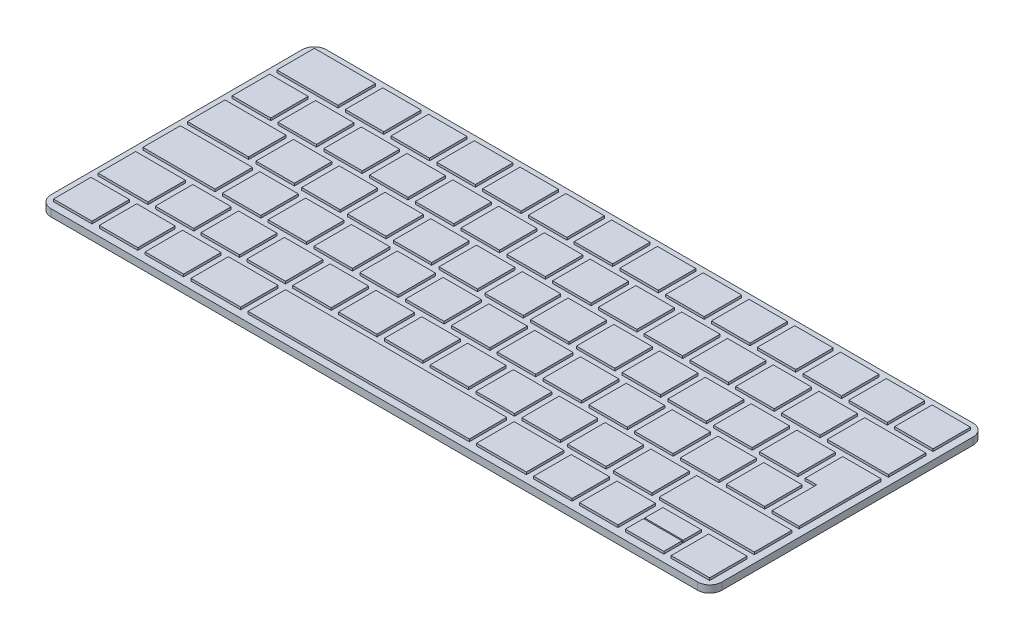
from build123d import *

# Parameters (mm, degrees)
SKETCH2_W       = 114.5
SKETCH2_H       = 3
BODY_DEPTH      = 139.5
SKETCH3_W       = 16
SKETCH3_H       = 15.583333333
SKETCH3_W_2     = 20.7
SKETCH3_W_3     = 92
SKETCH3_H_2     = 15.583333334
SKETCH3_W_4     = 39.536363636
SKETCH3_W_5     = 30
SKETCH3_W_6     = 11.2
SKETCH3_W_7     = 25.4
KEYS_A_DEPTH    = 1
SKETCH4_W       = 25.4
SKETCH4_H       = 15.583333333
SKETCH4_W_2     = 15.984615384
SKETCH4_W_3     = 15.984615385
KEYS_B_DEPTH    = 1
KEY_ENTER_REACH = 182.517
SKETCH5_W       = 11.2
SKETCH5_H       = 3
SKETCH6_W       = 16
SKETCH6_H       = 0.5
SLIT_DEPTH      = 1
CORNER_R        = 5


with BuildPart() as part:
    # Sketch2 → Body (new, symmetric)
    with BuildSketch(Plane(origin=(0, 0, 0), x_dir=(0, 0, -1), z_dir=(1, 0, 0))):
        with Locations((-57.25, 1.5)):
            Rectangle(SKETCH2_W, SKETCH2_H)
    extrude(amount=BODY_DEPTH, both=True)

    # Sketch3 → Keys A (add)
    with BuildSketch(Plane(origin=(0, 3, 0), x_dir=(1, 0, 0), z_dir=(0, 1, 0))):
        with Locations((-128.445454545, -103.708333334)):
            Rectangle(SKETCH3_W, SKETCH3_H)
        with Locations((-109.390909091, -103.708333334)):
            Rectangle(SKETCH3_W, SKETCH3_H)
        with Locations((-90.336363636, -103.708333334)):
            Rectangle(SKETCH3_W, SKETCH3_H)
        with Locations((-68.931818182, -103.708333334)):
            Rectangle(SKETCH3_W_2, SKETCH3_H)
        with Locations((-9.527272727, -103.708333334)):
            Rectangle(SKETCH3_W_3, SKETCH3_H)
        with Locations((49.877272727, -103.708333334)):
            Rectangle(SKETCH3_W_2, SKETCH3_H)
        with Locations((71.281818182, -103.708333334)):
            Rectangle(SKETCH3_W, SKETCH3_H)
        with Locations((90.336363636, -103.708333334)):
            Rectangle(SKETCH3_W, SKETCH3_H)
        with Locations((109.390909091, -103.708333334)):
            Rectangle(SKETCH3_W, SKETCH3_H)
        with Locations((128.445454545, -103.708333334)):
            Rectangle(SKETCH3_W, SKETCH3_H)
        with Locations((-126.095454545, -85.125)):
            Rectangle(SKETCH3_W_2, SKETCH3_H_2)
        with Locations((-104.690909091, -85.125)):
            Rectangle(SKETCH3_W, SKETCH3_H_2)
        with Locations((-85.636363636, -85.125)):
            Rectangle(SKETCH3_W, SKETCH3_H_2)
        with Locations((-66.581818182, -85.125)):
            Rectangle(SKETCH3_W, SKETCH3_H_2)
        with Locations((-47.527272727, -85.125)):
            Rectangle(SKETCH3_W, SKETCH3_H_2)
        with Locations((-28.472727273, -85.125)):
            Rectangle(SKETCH3_W, SKETCH3_H_2)
        with Locations((-9.418181818, -85.125)):
            Rectangle(SKETCH3_W, SKETCH3_H_2)
        with Locations((9.636363636, -85.125)):
            Rectangle(SKETCH3_W, SKETCH3_H_2)
        with Locations((28.690909091, -85.125)):
            Rectangle(SKETCH3_W, SKETCH3_H_2)
        with Locations((47.745454545, -85.125)):
            Rectangle(SKETCH3_W, SKETCH3_H_2)
        with Locations((66.8, -85.125)):
            Rectangle(SKETCH3_W, SKETCH3_H_2)
        with Locations((85.854545455, -85.125)):
            Rectangle(SKETCH3_W, SKETCH3_H_2)
        with Locations((116.677272727, -85.125)):
            Rectangle(SKETCH3_W_4, SKETCH3_H_2)
        with Locations((-121.445454545, -66.541666667)):
            Rectangle(SKETCH3_W_5, SKETCH3_H)
        with Locations((-95.392307692, -66.541666667)):
            Rectangle(SKETCH3_W, SKETCH3_H)
        with Locations((-76.339160839, -66.541666667)):
            Rectangle(SKETCH3_W, SKETCH3_H)
        with Locations((130.845454545, -66.541666667)):
            Rectangle(SKETCH3_W_6, SKETCH3_H)
        with Locations((-57.286013986, -66.541666667)):
            Rectangle(SKETCH3_W, SKETCH3_H)
        with Locations((-38.232867133, -66.541666667)):
            Rectangle(SKETCH3_W, SKETCH3_H)
        with Locations((-19.17972028, -66.541666667)):
            Rectangle(SKETCH3_W, SKETCH3_H)
        with Locations((-0.126573427, -66.541666667)):
            Rectangle(SKETCH3_W, SKETCH3_H)
        with Locations((18.926573427, -66.541666667)):
            Rectangle(SKETCH3_W, SKETCH3_H)
        with Locations((37.97972028, -66.541666667)):
            Rectangle(SKETCH3_W, SKETCH3_H)
        with Locations((57.032867133, -66.541666667)):
            Rectangle(SKETCH3_W, SKETCH3_H)
        with Locations((76.086013986, -66.541666667)):
            Rectangle(SKETCH3_W, SKETCH3_H)
        with Locations((95.139160839, -66.541666667)):
            Rectangle(SKETCH3_W, SKETCH3_H)
        with Locations((114.192307692, -66.541666667)):
            Rectangle(SKETCH3_W, SKETCH3_H)
        with Locations((-128.445454545, -29.375)):
            Rectangle(SKETCH3_W, SKETCH3_H_2)
        with Locations((-109.407692308, -29.375)):
            Rectangle(SKETCH3_W, SKETCH3_H_2)
        with Locations((-90.36993007, -29.375)):
            Rectangle(SKETCH3_W, SKETCH3_H_2)
        with Locations((-71.332167832, -29.375)):
            Rectangle(SKETCH3_W, SKETCH3_H_2)
        with Locations((-52.294405594, -29.375)):
            Rectangle(SKETCH3_W, SKETCH3_H_2)
        with Locations((-33.256643357, -29.375)):
            Rectangle(SKETCH3_W, SKETCH3_H_2)
        with Locations((-14.218881119, -29.375)):
            Rectangle(SKETCH3_W, SKETCH3_H_2)
        with Locations((4.818881119, -29.375)):
            Rectangle(SKETCH3_W, SKETCH3_H_2)
        with Locations((23.856643357, -29.375)):
            Rectangle(SKETCH3_W, SKETCH3_H_2)
        with Locations((42.894405594, -29.375)):
            Rectangle(SKETCH3_W, SKETCH3_H_2)
        with Locations((61.932167832, -29.375)):
            Rectangle(SKETCH3_W, SKETCH3_H_2)
        with Locations((80.96993007, -29.375)):
            Rectangle(SKETCH3_W, SKETCH3_H_2)
        with Locations((100.007692308, -29.375)):
            Rectangle(SKETCH3_W, SKETCH3_H_2)
        with Locations((123.745454545, -29.375)):
            Rectangle(SKETCH3_W_7, SKETCH3_H_2)
    extrude(amount=KEYS_A_DEPTH)

    # Sketch4 → Keys B (add)
    with BuildSketch(Plane(origin=(0, 3, 0), x_dir=(1, 0, 0), z_dir=(0, 1, 0))):
        with Locations((-123.745454545, -47.958333334)):
            Rectangle(SKETCH4_W, SKETCH4_H)
        with Locations((-100, -47.958333334)):
            Rectangle(SKETCH4_W_2, SKETCH4_H)
        with Locations((-80.962237762, -47.958333334)):
            Rectangle(SKETCH4_W_3, SKETCH4_H)
        with Locations((-61.924475525, -47.958333334)):
            Rectangle(SKETCH4_W_3, SKETCH4_H)
        with Locations((-42.886713287, -47.958333334)):
            Rectangle(SKETCH4_W_3, SKETCH4_H)
        with Locations((-23.848951049, -47.958333334)):
            Rectangle(SKETCH4_W_2, SKETCH4_H)
        with Locations((-4.811188811, -47.958333334)):
            Rectangle(SKETCH4_W_2, SKETCH4_H)
        with Locations((14.226573427, -47.958333334)):
            Rectangle(SKETCH4_W_3, SKETCH4_H)
        with Locations((33.264335665, -47.958333334)):
            Rectangle(SKETCH4_W_3, SKETCH4_H)
        with Locations((52.302097902, -47.958333334)):
            Rectangle(SKETCH4_W_2, SKETCH4_H)
        with Locations((71.33986014, -47.958333334)):
            Rectangle(SKETCH4_W_2, SKETCH4_H)
        with Locations((90.377622378, -47.958333334)):
            Rectangle(SKETCH4_W_3, SKETCH4_H)
        with Locations((109.415384616, -47.958333334)):
            Rectangle(SKETCH4_W_3, SKETCH4_H)
        with Locations((-123.745454545, -10.791666667)):
            Rectangle(SKETCH4_W, SKETCH4_H)
        with Locations((-100, -10.791666667)):
            Rectangle(SKETCH4_W_2, SKETCH4_H)
        with Locations((-80.962237762, -10.791666667)):
            Rectangle(SKETCH4_W_3, SKETCH4_H)
        with Locations((-61.924475525, -10.791666667)):
            Rectangle(SKETCH4_W_3, SKETCH4_H)
        with Locations((-42.886713287, -10.791666667)):
            Rectangle(SKETCH4_W_3, SKETCH4_H)
        with Locations((-23.848951049, -10.791666667)):
            Rectangle(SKETCH4_W_2, SKETCH4_H)
        with Locations((-4.811188811, -10.791666667)):
            Rectangle(SKETCH4_W_2, SKETCH4_H)
        with Locations((14.226573427, -10.791666667)):
            Rectangle(SKETCH4_W_3, SKETCH4_H)
        with Locations((128.453146853, -47.958333334)):
            Rectangle(SKETCH4_W_2, SKETCH4_H)
        with Locations((33.264335665, -10.791666667)):
            Rectangle(SKETCH4_W_3, SKETCH4_H)
        with Locations((52.302097902, -10.791666667)):
            Rectangle(SKETCH4_W_2, SKETCH4_H)
        with Locations((71.33986014, -10.791666667)):
            Rectangle(SKETCH4_W_2, SKETCH4_H)
        with Locations((90.377622378, -10.791666667)):
            Rectangle(SKETCH4_W_3, SKETCH4_H)
        with Locations((109.415384616, -10.791666667)):
            Rectangle(SKETCH4_W_3, SKETCH4_H)
        with Locations((128.453146853, -10.791666667)):
            Rectangle(SKETCH4_W_2, SKETCH4_H)
    extrude(amount=KEYS_B_DEPTH)

    # Sketch5 → Key Enter (add, up to next)
    with BuildSketch(Plane(origin=(0, 4, 0), x_dir=(1, 0, 0), z_dir=(0, 1, 0)), mode=Mode.PRIVATE) as key_enter_sk1:
        with Locations((130.845454545, -57.25)):
            Rectangle(SKETCH5_W, SKETCH5_H)
    key_enter_tool1 = extrude(key_enter_sk1.sketch, amount=-KEY_ENTER_REACH, mode=Mode.PRIVATE) - part.part
    add(key_enter_tool1.solids().sort_by_distance((130.845455, 4, 57.25))[0])

    # Sketch6 → Slit (cut)
    with BuildSketch(Plane(origin=(0, 4, 0), x_dir=(1, 0, 0), z_dir=(0, 1, 0))):
        with Locations((109.390909091, -103.708333333)):
            Rectangle(SKETCH6_W, SKETCH6_H)
    extrude(amount=-SLIT_DEPTH, mode=Mode.SUBTRACT)

    # Corner
    corner_edges = [part.edges().sort_by_distance(p)[0] for p in [
        (139.5, 1.5, 114.5),
        (139.5, 1.5, 0),
        (-139.5, 1.5, 114.5),
        (-139.5, 1.5, 0),
    ]]
    fillet(corner_edges, radius=CORNER_R)


solid = part.part
